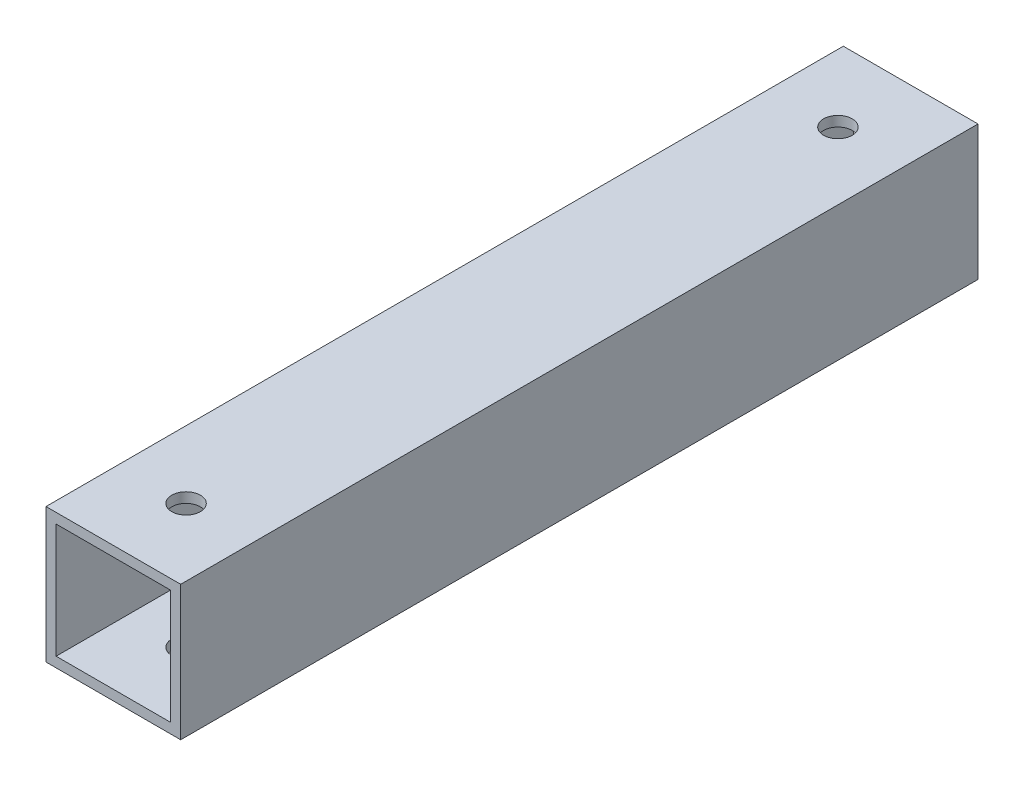
from build123d import *

# Parameters (mm, degrees)
SKETCH1_W           = 20
SKETCH1_H           = 20
SKETCH1_W_2         = 17
SKETCH1_H_2         = 17
BOSS_EXTRUDE1_DEPTH = 118.4
SKETCH2_R           = 2.125
CUT_EXTRUDE1_DEPTH  = 121.492987348


with BuildPart() as part:
    # Sketch1 → Boss-Extrude1 (new body)
    with BuildSketch(Plane.XY):
        Rectangle(SKETCH1_W, SKETCH1_H)
        Rectangle(SKETCH1_W_2, SKETCH1_H_2, mode=Mode.SUBTRACT)
    extrude(amount=-BOSS_EXTRUDE1_DEPTH)

    # Sketch2 → Cut-Extrude1 (cut, through all)
    with BuildSketch(Plane(origin=(0, 10, 0), x_dir=(1, 0, 0), z_dir=(0, 1, 0))):
        with Locations(Location((0, 10.8, 0), (0, 0, 270))):
            Circle(SKETCH2_R)
        with Locations(Location((0, 107.6, 0), (0, 0, 90))):
            Circle(SKETCH2_R)
    extrude(amount=-CUT_EXTRUDE1_DEPTH, mode=Mode.SUBTRACT)


solid = part.part
